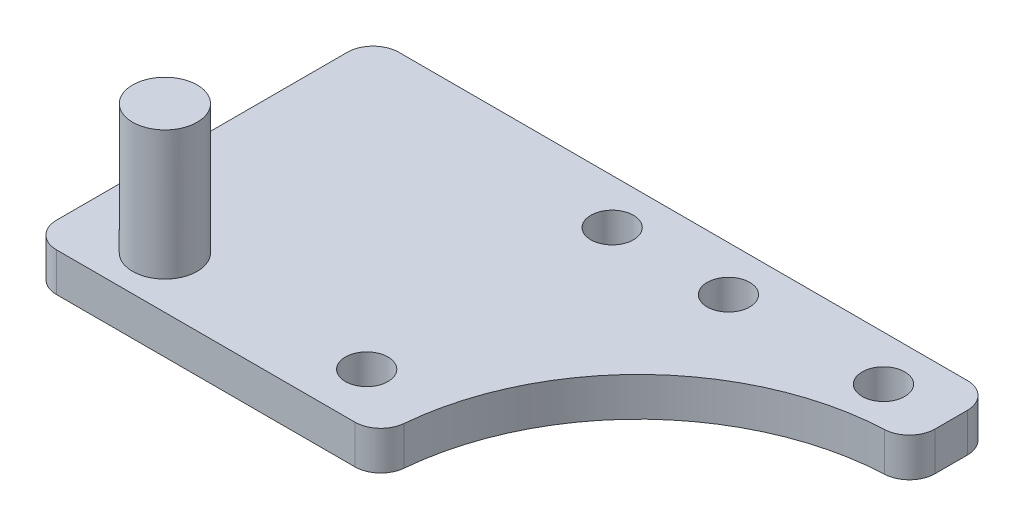
from build123d import *

# Parameters (mm, degrees)
SKETCH1_R            = 1.65
MAIN_BODY_DEPTH      = 3
SKETCH2_R            = 2.5
CONNECTING_ROD_DEPTH = 10
FILLET1_R            = 2


with BuildPart() as part:
    # Sketch1 → Main Body (new body)
    with BuildSketch(Plane(origin=(0, 0, 0), x_dir=(1, 0, 0), z_dir=(0, 1, 0))):
        with BuildLine():
            Line((9, -4), (9, 22.493705841))
            Line((9, 22.493705841), (21, 22.493705841))
            Line((21, 22.493705841), (57, 22.493705841))
            Line((57, 22.493705841), (57, 21))
            Line((57, 21), (57, 16))
            ThreePointArc((57, 16), (42.206880906, 10.507775049), (36, -4))
            Line((36, -4), (9, -4))
        make_face()
        with Locations(Location((31, 19, 0), (0, 0, 270))):
            Circle(SKETCH1_R, mode=Mode.SUBTRACT)
        with Locations(Location((40, 19, 0), (0, 0, 270))):
            Circle(SKETCH1_R, mode=Mode.SUBTRACT)
        with Locations(Location((52, 19, 0), (0, 0, 270))):
            Circle(SKETCH1_R, mode=Mode.SUBTRACT)
        with Locations(Location((31, 0, 0), (0, 0, 270))):
            Circle(SKETCH1_R, mode=Mode.SUBTRACT)
    extrude(amount=MAIN_BODY_DEPTH)

    # Sketch2 → Connecting Rod (add)
    with BuildSketch(Plane(origin=(0, 3, 0), x_dir=(1, 0, 0), z_dir=(0, 1, 0))):
        with Locations(Location((15.380746581, 0, 0), (0, 0, 90))):
            Circle(SKETCH2_R)
    extrude(amount=CONNECTING_ROD_DEPTH)

    # Fillet1
    fillet1_edges = [part.edges().sort_by_distance(p)[0] for p in [
        (57, 1.5, -22.493705841),
        (57, 1.5, -16),
        (36, 1.5, 4),
        (9, 1.5, 4),
        (9, 1.5, -22.493705841),
    ]]
    fillet(fillet1_edges, radius=FILLET1_R)


solid = part.part
